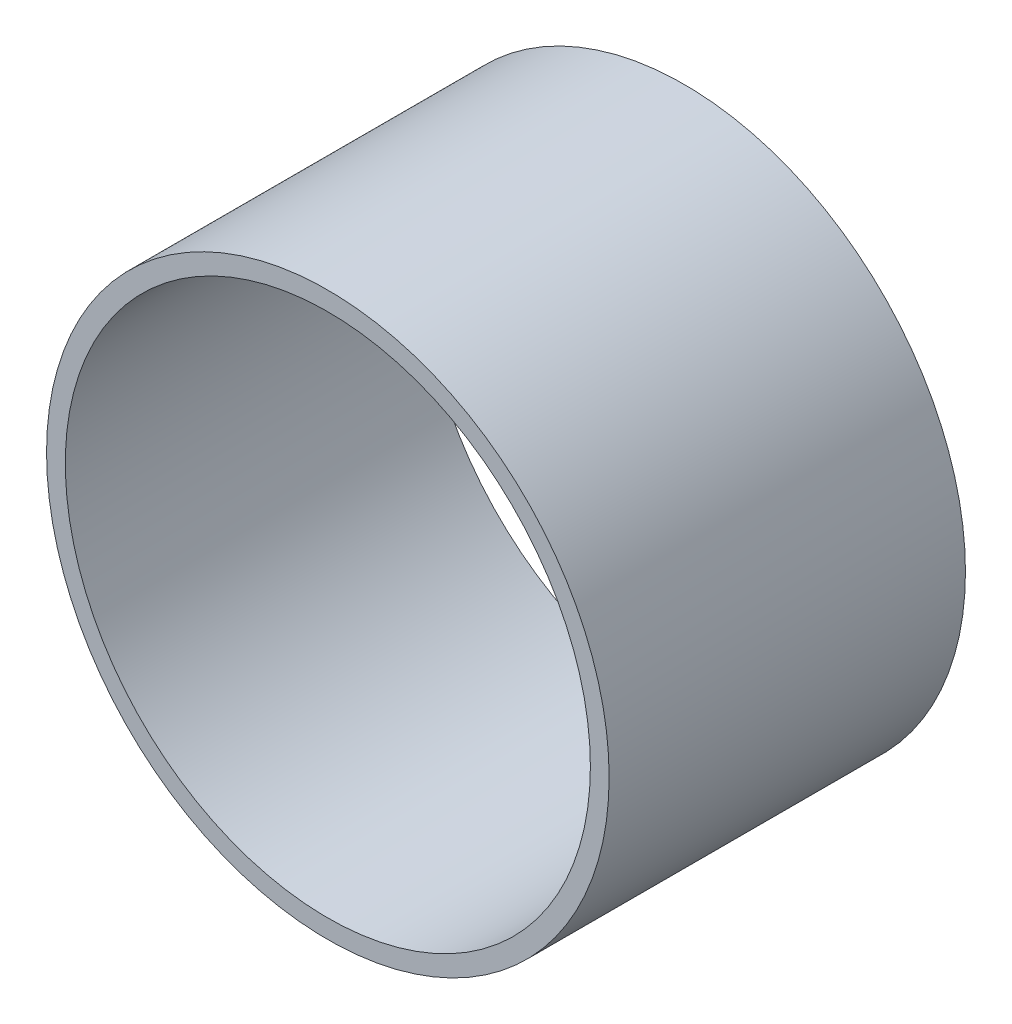
from build123d import *

# Parameters (mm, degrees)
SKIZZE1_R                       = 7.5
SKIZZE1_R_2                     = 7
AUFSATZ_LINEAR_AUSTRAGEN1_DEPTH = 9.5


with BuildPart() as part:
    # Skizze1 → Aufsatz-Linear austragen1 (new body)
    with BuildSketch(Plane.XY):
        Circle(SKIZZE1_R)
        Circle(SKIZZE1_R_2, mode=Mode.SUBTRACT)
    extrude(amount=AUFSATZ_LINEAR_AUSTRAGEN1_DEPTH)


solid = part.part
